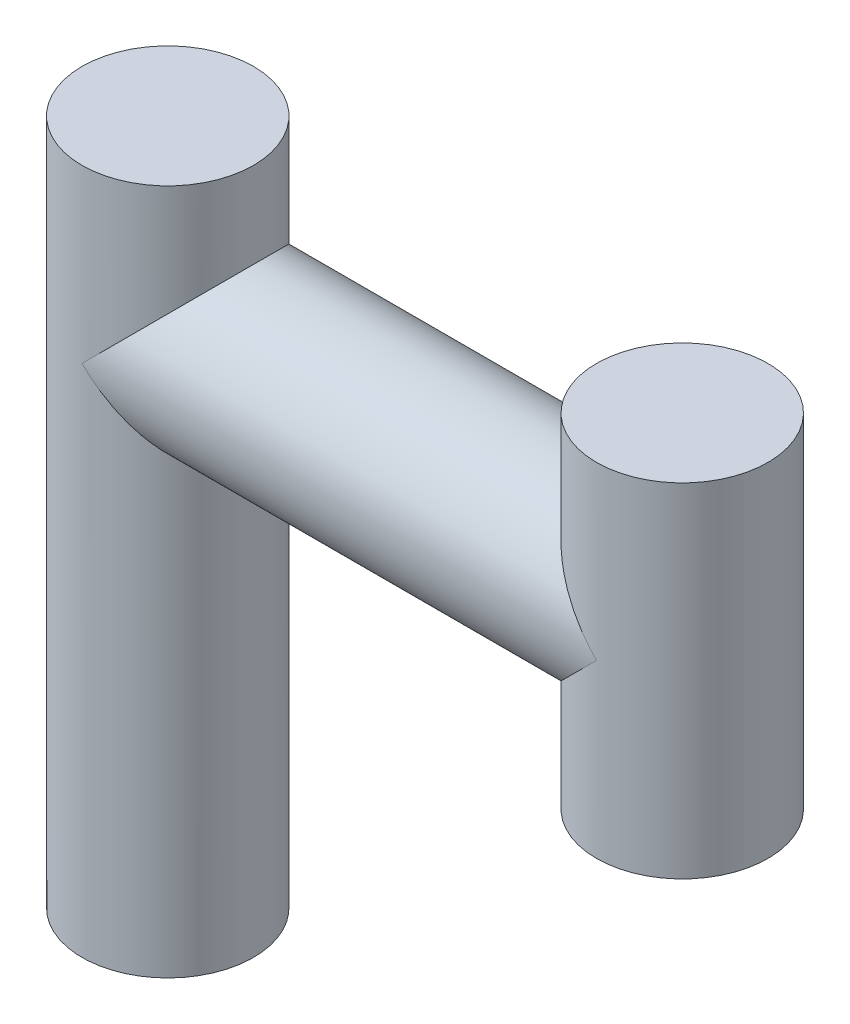
from build123d import *

# Parameters (mm, degrees)
SKETCH2_R           = 2.5
BOSS_EXTRUDE2_DEPTH = 10
SKETCH3_R           = 2.5
BOSS_EXTRUDE3_DEPTH = 7.5
BOSS_EXTRUDE4_START = 10
SKETCH4_R           = 2.5
BOSS_EXTRUDE4_DEPTH = 10


with BuildPart() as part:
    # Sketch2 → Boss-Extrude2 (new body)
    with BuildSketch(Plane(origin=(0, 0, 0), x_dir=(1, 0, 0), z_dir=(0, 1, 0))):
        with Locations(Location((0, 0, 0), (0, 0, 270))):
            Circle(SKETCH2_R)
    boss_extrude2 = extrude(amount=BOSS_EXTRUDE2_DEPTH)

    # Sketch3 → Boss-Extrude3 (add)
    with BuildSketch(Plane(origin=(0, 0, 0), x_dir=(0, 0, -1), z_dir=(1, 0, 0))):
        with Locations((0, 5)):
            Circle(SKETCH3_R)
    boss_extrude3 = extrude(amount=BOSS_EXTRUDE3_DEPTH)

    # Mirror5: Boss-Extrude2, Boss-Extrude3 across plane
    add(boss_extrude2.mirror(Plane(origin=(7.5, 5, 0), x_dir=(0, 0, 1), z_dir=(1, 0, 0))))
    add(boss_extrude3.mirror(Plane(origin=(7.5, 5, 0), x_dir=(0, 0, 1), z_dir=(1, 0, 0))))

    # Sketch4 → Boss-Extrude4 (add)
    with BuildSketch(Plane.XZ.offset(BOSS_EXTRUDE4_START)):
        with Locations(Location((0, 0, 0), (0, 0, 270))):
            Circle(SKETCH4_R)
    extrude(amount=-BOSS_EXTRUDE4_DEPTH)


solid = part.part
